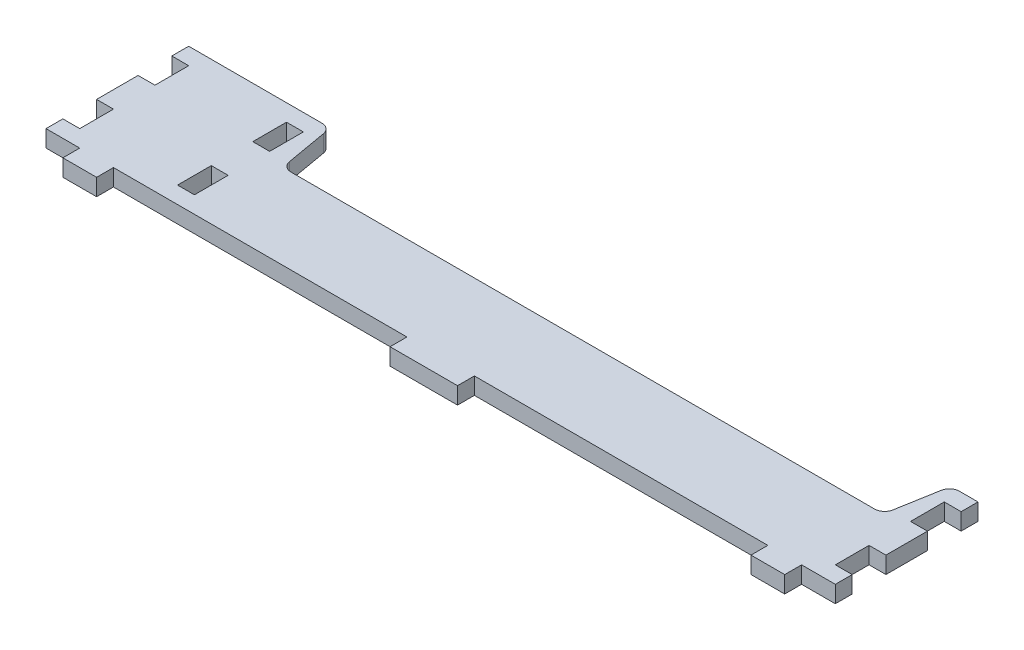
from build123d import *

# Parameters (mm, degrees)
SKETCH_1_W      = 5
SKETCH_1_H      = 10
EXTRUDE_1_DEPTH = 5


with BuildPart() as part:
    # 草图1 → 凸台-拉伸1 (new body)
    with BuildSketch(Plane(origin=(0, 0, 0), x_dir=(1, 0, 0), z_dir=(0, 1, 0))):
        with BuildLine():
            Line((-117, 21.15), (-77.52077205, 21.15))
            ThreePointArc((-77.52077205, 21.15), (-75.590849256, 20.446823461), (-74.565644083, 18.666932006))
            Line((-74.565644083, 18.666932006), (-72.434355917, 6.483067994))
            ThreePointArc((-72.434355917, 6.483067994), (-71.409150744, 4.703176539), (-69.47922795, 4))
            Line((-69.47922795, 4), (103.47922795, 4))
            ThreePointArc((103.47922795, 4), (105.409150744, 4.703176539), (106.434355917, 6.483067994))
            Line((106.434355917, 6.483067994), (108.565644083, 18.666932006))
            ThreePointArc((108.565644083, 18.666932006), (109.590849256, 20.446823461), (111.52077205, 21.15))
            Line((111.52077205, 21.15), (117, 21.15))
            Line((117, 21.15), (117, 16.15))
            Line((117, 16.15), (112, 16.15))
            Line((112, 16.15), (112, 6.15))
            Line((112, 6.15), (117, 6.15))
            Line((117, 6.15), (117, -6.15))
            Line((117, -6.15), (112, -6.15))
            Line((112, -6.15), (112, -16.15))
            Line((112, -16.15), (117, -16.15))
            Line((117, -16.15), (117, -21.15))
            Line((117, -21.15), (107, -21.15))
            Line((107, -21.15), (107, -26.15))
            Line((107, -26.15), (97, -26.15))
            Line((97, -26.15), (97, -21.15))
            Line((97, -21.15), (10, -21.15))
            Line((10, -21.15), (10, -26.15))
            Line((10, -26.15), (-10, -26.15))
            Line((-10, -26.15), (-10, -21.15))
            Line((-10, -21.15), (-97, -21.15))
            Line((-97, -21.15), (-97, -26.15))
            Line((-97, -26.15), (-107, -26.15))
            Line((-107, -26.15), (-107, -21.15))
            Line((-107, -21.15), (-117, -21.15))
            Line((-117, -21.15), (-117, -16.15))
            Line((-117, -16.15), (-112, -16.15))
            Line((-112, -16.15), (-112, -6.15))
            Line((-112, -6.15), (-117, -6.15))
            Line((-117, -6.15), (-117, 6.15))
            Line((-117, 6.15), (-112, 6.15))
            Line((-112, 6.15), (-112, 16.15))
            Line((-112, 16.15), (-117, 16.15))
            Line((-117, 16.15), (-117, 21.15))
        make_face()
        with Locations((-80.5, 11.15)):
            Rectangle(SKETCH_1_W, SKETCH_1_H, mode=Mode.SUBTRACT)
        with Locations((-80.5, -11.15)):
            Rectangle(SKETCH_1_W, SKETCH_1_H, mode=Mode.SUBTRACT)
    extrude(amount=EXTRUDE_1_DEPTH)


solid = part.part
